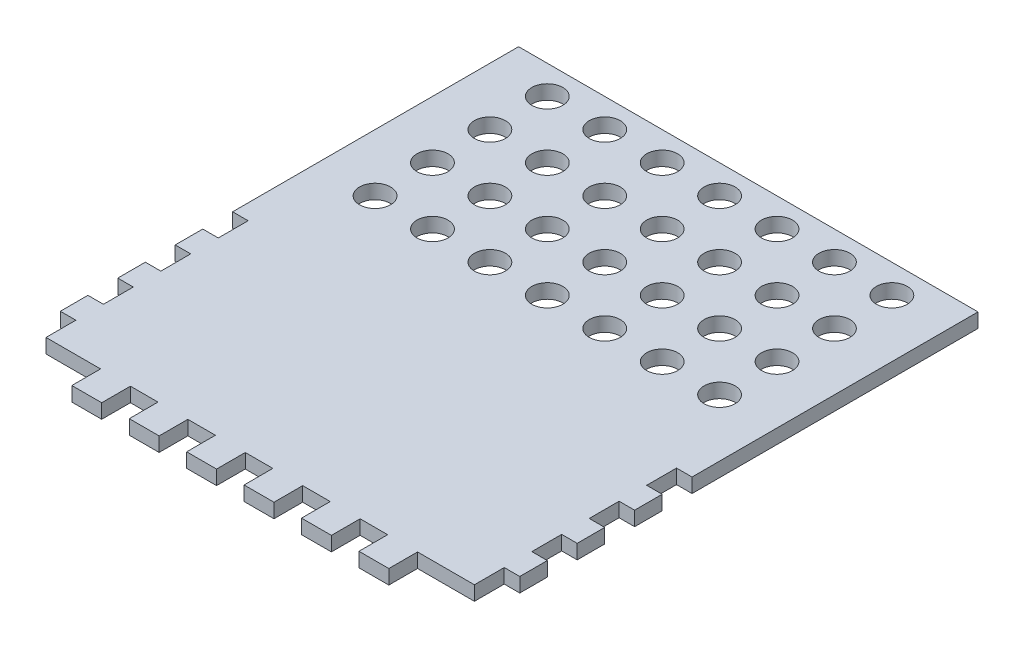
from build123d import *

# Parameters (mm, degrees)
SKETCH1_W               = 101.6
SKETCH1_H               = 107.95
BOSS_EXTRUDE1_DEPTH     = 3.175
CUT_EXTRUDE1_DEPTH      = 75.189091179
CUT_EXTRUDE1_DEPTH_BACK = 75.189091179
SKETCH2_W               = 3.429
SKETCH2_H               = 6.604
SKETCH3_W               = 101.6
SKETCH3_H               = 50.8
CUT_EXTRUDE2_DEPTH      = 75.189091179
SKETCH4_W               = 101.6
SKETCH4_H               = 57.15
SKETCH4_R               = 3.429
BOSS_EXTRUDE2_DEPTH     = 3.175


with BuildPart() as part:
    # Sketch1 → Boss-Extrude1 (new body)
    with BuildSketch(Plane(origin=(0, 0, 0), x_dir=(1, 0, 0), z_dir=(0, 1, 0))):
        Rectangle(SKETCH1_W, SKETCH1_H)
    extrude(amount=BOSS_EXTRUDE1_DEPTH)

    # Sketch2 → Cut-Extrude1 (cut, two sides: drawn at the far end of the back side and taken through both)
    with BuildSketch(Plane(origin=(0, 3.175, 0), x_dir=(1, 0, 0), z_dir=(0, 1, 0)).offset(-CUT_EXTRUDE1_DEPTH_BACK)):
        Polygon((22.098, -47.625), (28.194, -47.625), (28.194, -54.229), (34.798, -54.229), (34.798, -47.625), (47.371, -47.625), (47.371, -41.021), (50.8, -41.021), (50.8, -47.625), (50.8, -92.544961432), (-50.8, -92.544961432), (-50.8, -47.625), (-50.8, -41.021), (-47.371, -41.021), (-47.371, -47.625), (-35.306, -47.625), (-35.306, -54.229), (-28.702, -54.229), (-28.702, -47.625), (-22.606, -47.625), (-22.606, -54.229), (-16.002, -54.229), (-16.002, -47.625), (-9.906, -47.625), (-9.906, -54.229), (-3.302, -54.229), (-3.302, -47.625), (2.794, -47.625), (2.794, -54.229), (9.398, -54.229), (9.398, -47.625), (15.494, -47.625), (15.494, -54.229), (22.098, -54.229), align=None)
        with Locations((-49.0855, 31.75)):
            Rectangle(SKETCH2_W, SKETCH2_H)
        with Locations((-49.0855, 19.177)):
            Rectangle(SKETCH2_W, SKETCH2_H)
        with Locations((-49.0855, 6.477)):
            Rectangle(SKETCH2_W, SKETCH2_H)
        with Locations((-49.0855, -6.223)):
            Rectangle(SKETCH2_W, SKETCH2_H)
        with Locations((-49.0855, -18.923)):
            Rectangle(SKETCH2_W, SKETCH2_H)
        with Locations((-49.0855, -31.623)):
            Rectangle(SKETCH2_W, SKETCH2_H)
        with Locations((49.0855, -31.623)):
            Rectangle(SKETCH2_W, SKETCH2_H)
        with Locations((49.0855, -18.923)):
            Rectangle(SKETCH2_W, SKETCH2_H)
        with Locations((49.0855, -6.223)):
            Rectangle(SKETCH2_W, SKETCH2_H)
        with Locations((49.0855, 6.477)):
            Rectangle(SKETCH2_W, SKETCH2_H)
        with Locations((49.0855, 19.177)):
            Rectangle(SKETCH2_W, SKETCH2_H)
        with Locations((49.0855, 31.75)):
            Rectangle(SKETCH2_W, SKETCH2_H)
        with Locations((49.0855, 44.45)):
            Rectangle(SKETCH2_W, SKETCH2_H)
        with Locations((-49.0855, 44.45)):
            Rectangle(SKETCH2_W, SKETCH2_H)
    extrude(amount=CUT_EXTRUDE1_DEPTH + CUT_EXTRUDE1_DEPTH_BACK, mode=Mode.SUBTRACT)

    # Sketch3 → Cut-Extrude2 (cut, through all)
    with BuildSketch(Plane(origin=(0, 3.175, 0), x_dir=(1, 0, 0), z_dir=(0, 1, 0))):
        with Locations((0, 28.575)):
            Rectangle(SKETCH3_W, SKETCH3_H)
    extrude(amount=-CUT_EXTRUDE2_DEPTH, mode=Mode.SUBTRACT)

    # Sketch4 → Boss-Extrude2 (add)
    with BuildSketch(Plane(origin=(0, 3.175, 0), x_dir=(1, 0, 0), z_dir=(0, 1, 0))):
        with Locations((0, 31.75)):
            Rectangle(SKETCH4_W, SKETCH4_H)
        with Locations(Location((-38.1, 15.875, 0), (0, 0, 270))):
            Circle(SKETCH4_R, mode=Mode.SUBTRACT)
        with Locations(Location((-25.4, 15.875, 0), (0, 0, 270))):
            Circle(SKETCH4_R, mode=Mode.SUBTRACT)
        with Locations(Location((-12.7, 15.875, 0), (0, 0, 270))):
            Circle(SKETCH4_R, mode=Mode.SUBTRACT)
        with Locations(Location((0, 15.875, 0), (0, 0, 270))):
            Circle(SKETCH4_R, mode=Mode.SUBTRACT)
        with Locations(Location((12.7, 15.875, 0), (0, 0, 270))):
            Circle(SKETCH4_R, mode=Mode.SUBTRACT)
        with Locations(Location((25.4, 15.875, 0), (0, 0, 270))):
            Circle(SKETCH4_R, mode=Mode.SUBTRACT)
        with Locations(Location((38.1, 15.875, 0), (0, 0, 270))):
            Circle(SKETCH4_R, mode=Mode.SUBTRACT)
        with Locations(Location((-25.4, 28.575, 0), (0, 0, 270))):
            Circle(SKETCH4_R, mode=Mode.SUBTRACT)
        with Locations(Location((-12.7, 28.575, 0), (0, 0, 270))):
            Circle(SKETCH4_R, mode=Mode.SUBTRACT)
        with Locations(Location((0, 28.575, 0), (0, 0, 270))):
            Circle(SKETCH4_R, mode=Mode.SUBTRACT)
        with Locations(Location((12.7, 28.575, 0), (0, 0, 270))):
            Circle(SKETCH4_R, mode=Mode.SUBTRACT)
        with Locations(Location((25.4, 28.575, 0), (0, 0, 270))):
            Circle(SKETCH4_R, mode=Mode.SUBTRACT)
        with Locations(Location((38.1, 28.575, 0), (0, 0, 270))):
            Circle(SKETCH4_R, mode=Mode.SUBTRACT)
        with Locations(Location((-25.4, 41.275, 0), (0, 0, 270))):
            Circle(SKETCH4_R, mode=Mode.SUBTRACT)
        with Locations(Location((-12.7, 41.275, 0), (0, 0, 270))):
            Circle(SKETCH4_R, mode=Mode.SUBTRACT)
        with Locations(Location((0, 41.275, 0), (0, 0, 270))):
            Circle(SKETCH4_R, mode=Mode.SUBTRACT)
        with Locations(Location((12.7, 41.275, 0), (0, 0, 270))):
            Circle(SKETCH4_R, mode=Mode.SUBTRACT)
        with Locations(Location((25.4, 41.275, 0), (0, 0, 270))):
            Circle(SKETCH4_R, mode=Mode.SUBTRACT)
        with Locations(Location((38.1, 41.275, 0), (0, 0, 270))):
            Circle(SKETCH4_R, mode=Mode.SUBTRACT)
        with Locations(Location((-25.4, 53.975, 0), (0, 0, 270))):
            Circle(SKETCH4_R, mode=Mode.SUBTRACT)
        with Locations(Location((-12.7, 53.975, 0), (0, 0, 270))):
            Circle(SKETCH4_R, mode=Mode.SUBTRACT)
        with Locations(Location((0, 53.975, 0), (0, 0, 270))):
            Circle(SKETCH4_R, mode=Mode.SUBTRACT)
        with Locations(Location((12.7, 53.975, 0), (0, 0, 270))):
            Circle(SKETCH4_R, mode=Mode.SUBTRACT)
        with Locations(Location((25.4, 53.975, 0), (0, 0, 270))):
            Circle(SKETCH4_R, mode=Mode.SUBTRACT)
        with Locations(Location((38.1, 53.975, 0), (0, 0, 270))):
            Circle(SKETCH4_R, mode=Mode.SUBTRACT)
        with Locations(Location((-38.1, 28.575, 0), (0, 0, 270))):
            Circle(SKETCH4_R, mode=Mode.SUBTRACT)
        with Locations(Location((-38.1, 41.275, 0), (0, 0, 270))):
            Circle(SKETCH4_R, mode=Mode.SUBTRACT)
        with Locations(Location((-38.1, 53.975, 0), (0, 0, 270))):
            Circle(SKETCH4_R, mode=Mode.SUBTRACT)
    extrude(amount=-BOSS_EXTRUDE2_DEPTH)


solid = part.part
